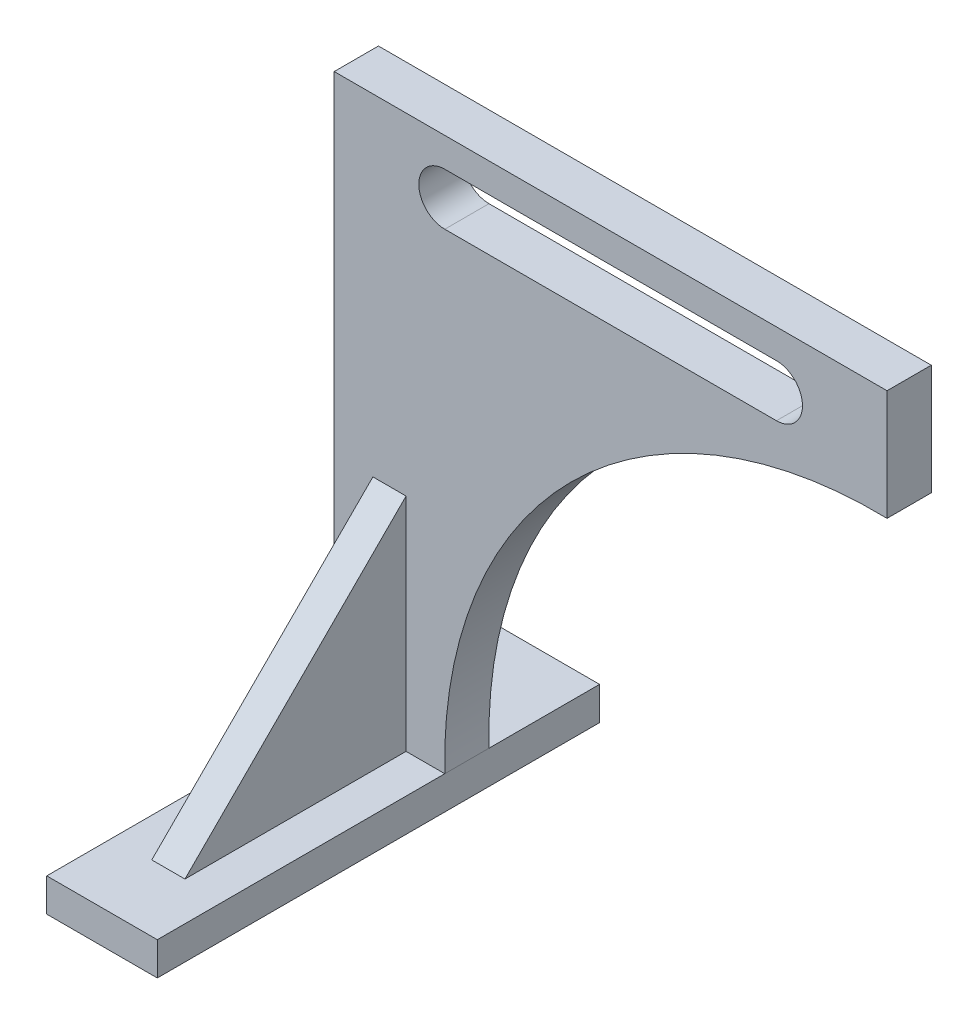
from build123d import *

# Parameters (mm, degrees)
SKETCH1_W           = 50
SKETCH1_H           = 200
BOSS_EXTRUDE1_DEPTH = 15
BOSS_EXTRUDE2_DEPTH = 20
BOSS_EXTRUDE3_DEPTH = 15


with BuildPart() as part:
    # Sketch1 → Boss-Extrude1 (new body)
    with BuildSketch(Plane(origin=(0, 0, 0), x_dir=(1, 0, 0), z_dir=(0, 1, 0))):
        Rectangle(SKETCH1_W, SKETCH1_H)
    extrude(amount=BOSS_EXTRUDE1_DEPTH)

    # Sketch2 → Boss-Extrude2 (add)
    with BuildSketch(Plane(origin=(0, 0, -30), x_dir=(-1, 0, 0), z_dir=(0, 0, -1))):
        with BuildLine():
            Line((25, 15), (25, 265))
            Line((25, 265), (-225, 265))
            Line((-225, 265), (-225, 215))
            ThreePointArc((-225, 215), (-82.144079422, 157.855920578), (-25, 15))
            Line((-25, 15), (25, 15))
        make_face()
        with BuildLine():
            Line((-25, 228.25), (-175, 228.25))
            ThreePointArc((-175, 228.25), (-186.75, 240), (-175, 251.75))
            Line((-175, 251.75), (-25, 251.75))
            ThreePointArc((-25, 251.75), (-13.25, 240), (-25, 228.25))
        make_face(mode=Mode.SUBTRACT)
    extrude(amount=BOSS_EXTRUDE2_DEPTH)

    # Sketch4 → Boss-Extrude3 (add)
    with BuildSketch(Plane.ZY.offset(7.5)):
        Polygon((-30, 115), (70, 15), (-30, 15), align=None)
    extrude(amount=-BOSS_EXTRUDE3_DEPTH)


solid = part.part
